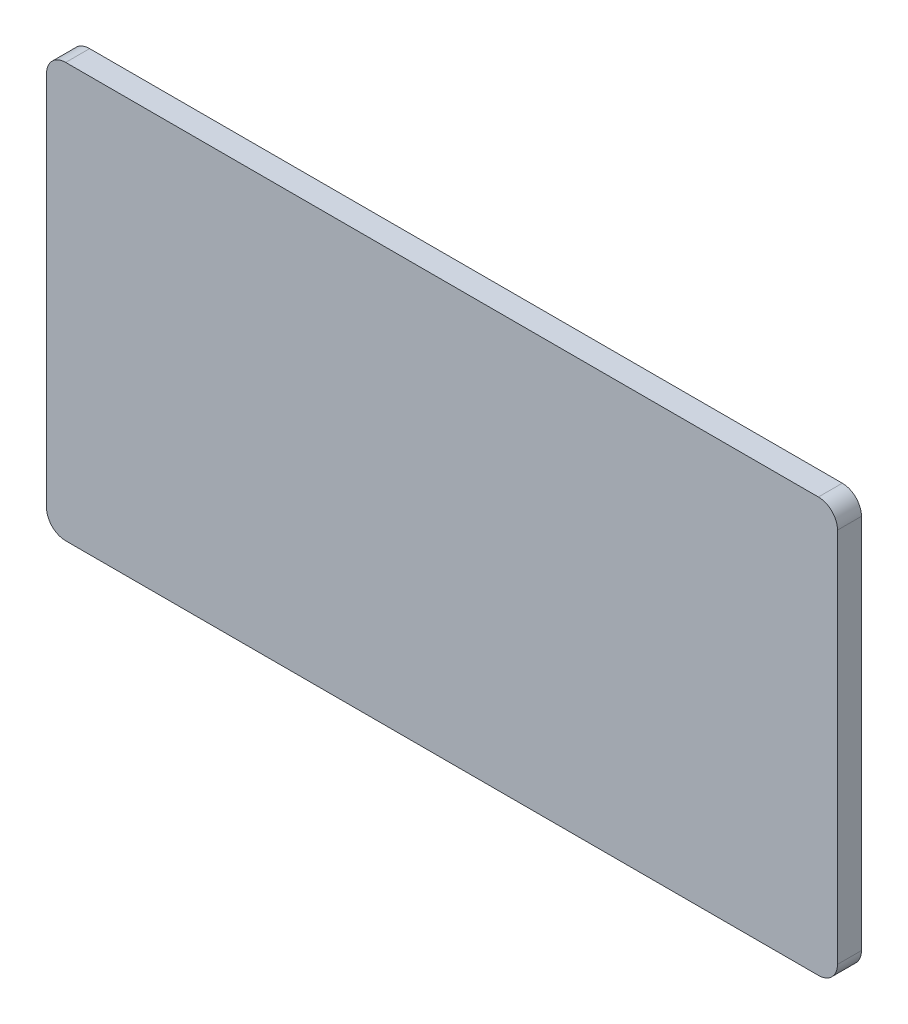
from build123d import *

# Parameters (mm, degrees)
SKETCH1_W           = 105
SKETCH1_H           = 55
BOSS_EXTRUDE1_DEPTH = 3.175
FILLET1_R           = 2.54


with BuildPart() as part:
    # Sketch1 → Boss-Extrude1 (new body)
    with BuildSketch(Plane.XY):
        Rectangle(SKETCH1_W, SKETCH1_H)
    extrude(amount=BOSS_EXTRUDE1_DEPTH)

    # Fillet1
    fillet1_edges = [part.edges().sort_by_distance(p)[0] for p in [
        (52.5, -27.5, 1.5875),
        (-52.5, -27.5, 1.5875),
        (-52.5, 27.5, 1.5875),
        (52.5, 27.5, 1.5875),
    ]]
    fillet(fillet1_edges, radius=FILLET1_R)


solid = part.part
